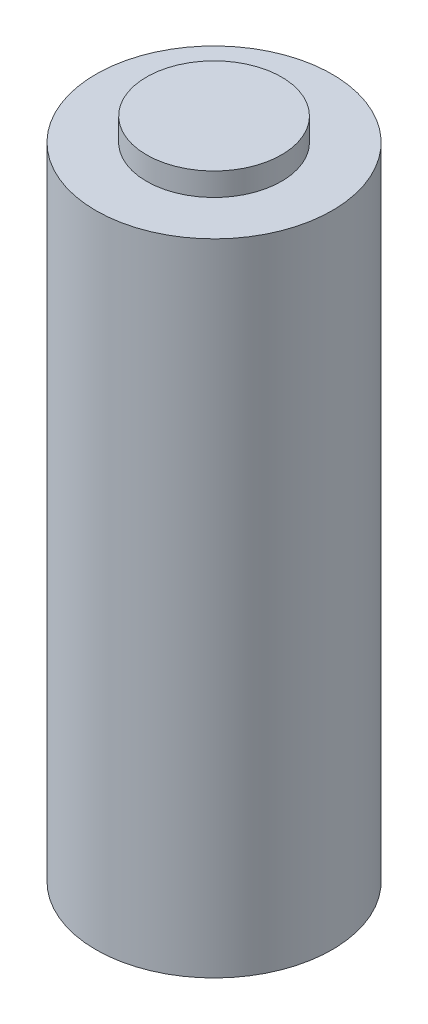
from build123d import *

# Parameters (mm, degrees)
CROQUIS1_R              = 5.15
SALIENTE_EXTRUIR1_DEPTH = 28.9
CORTAR_EXTRUIR1_START   = -1
CROQUIS2_R              = 5.15
CROQUIS2_R_2            = 2.941816229
CORTAR_EXTRUIR1_DEPTH   = 1


with BuildPart() as part:
    # Croquis1 → Saliente-Extruir1 (new body)
    with BuildSketch(Plane(origin=(0, 0, 0), x_dir=(1, 0, 0), z_dir=(0, 1, 0))):
        with Locations(Location((0, 0, 0), (0, 0, 270))):
            Circle(CROQUIS1_R)
    extrude(amount=SALIENTE_EXTRUIR1_DEPTH)

    # Croquis2 → Cortar-Extruir1 (cut)
    with BuildSketch(Plane(origin=(0, 28.9, 0), x_dir=(1, 0, 0), z_dir=(0, 1, 0)).offset(CORTAR_EXTRUIR1_START)):
        with Locations(Location((0, 0, 0), (0, 0, 270))):
            Circle(CROQUIS2_R)
        with Locations(Location((0, 0, 0), (0, 0, 270))):
            Circle(CROQUIS2_R_2, mode=Mode.SUBTRACT)
    extrude(amount=CORTAR_EXTRUIR1_DEPTH, mode=Mode.SUBTRACT)


solid = part.part
